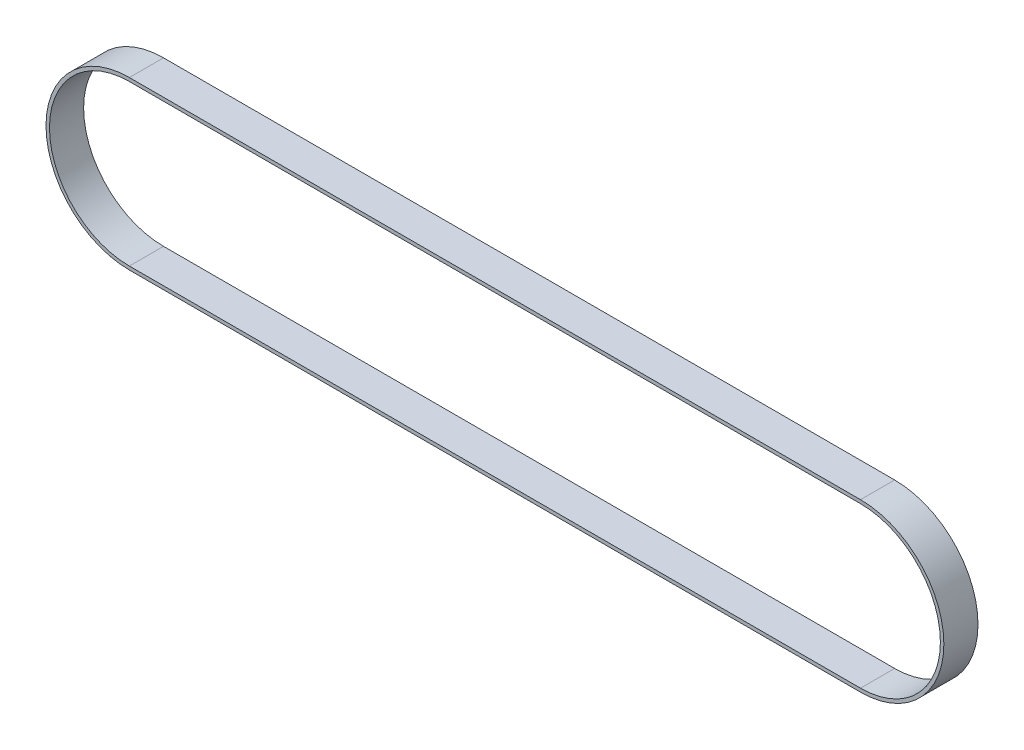
from build123d import *

# Parameters (mm, degrees)
BOSS_EXTRUDE1_DEPTH = 14.986


with BuildPart() as part:
    # Sketch1 → Boss-Extrude1 (new body)
    with BuildSketch(Plane.XY):
        with BuildLine():
            Line((0, 36.576), (-320.802, 36.576))
            ThreePointArc((-320.802, 36.576), (-357.378, 0), (-320.802, -36.576))
            Line((-320.802, -36.576), (0, -36.576))
            ThreePointArc((0, -36.576), (36.576, 0), (0, 36.576))
        make_face()
        with BuildLine():
            Line((0, 35.052), (-320.802, 35.052))
            ThreePointArc((-320.802, 35.052), (-355.854, 0), (-320.802, -35.052))
            Line((-320.802, -35.052), (0, -35.052))
            ThreePointArc((0, -35.052), (35.052, 0), (0, 35.052))
        make_face(mode=Mode.SUBTRACT)
    extrude(amount=BOSS_EXTRUDE1_DEPTH)


solid = part.part
